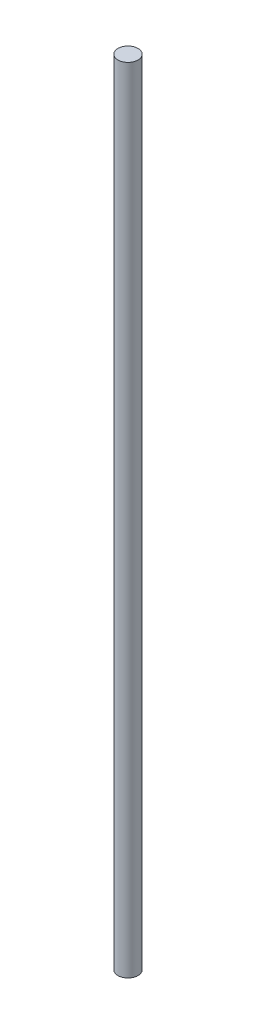
from build123d import *

# Parameters (mm, degrees)
SKETCH1_R           = 2.413
BOSS_EXTRUDE1_DEPTH = 190.5


with BuildPart() as part:
    # Sketch1 → Boss-Extrude1 (new body)
    with BuildSketch(Plane(origin=(0, 0, 0), x_dir=(1, 0, 0), z_dir=(0, 1, 0))):
        with Locations(Location((0, 0, 0), (0, 0, 270))):
            Circle(SKETCH1_R)
    extrude(amount=BOSS_EXTRUDE1_DEPTH)


solid = part.part
